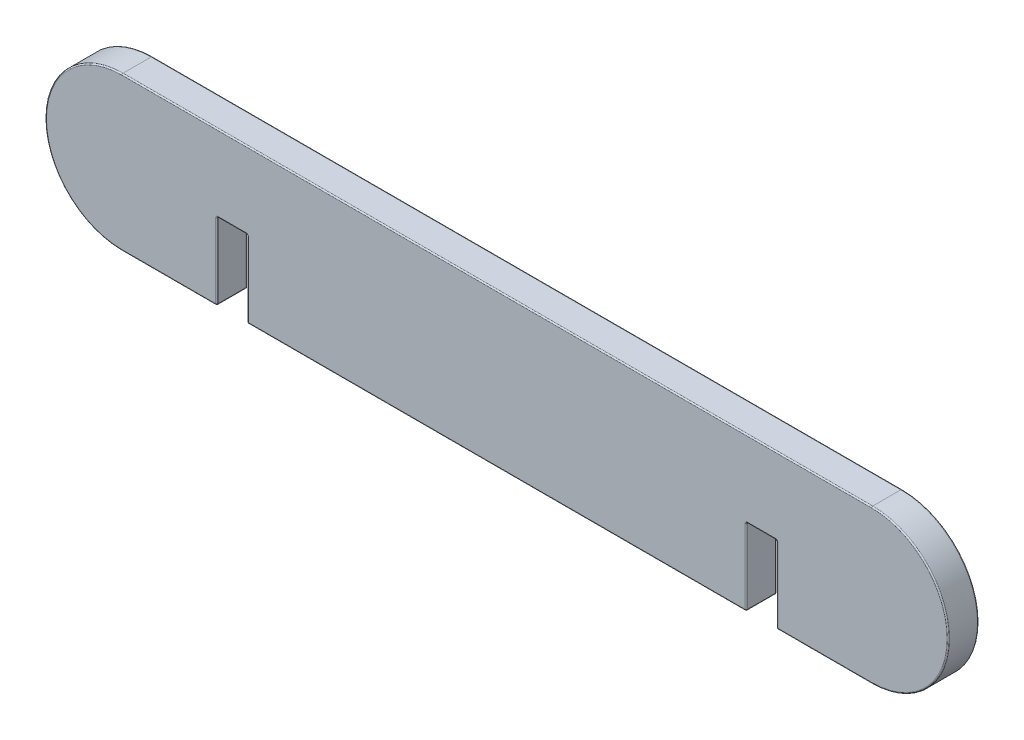
from build123d import *

# Parameters (mm, degrees)
RESSALTO_EXTRUS_O1_DEPTH = 2.5
FILETE1_R                = 0.1


with BuildPart() as part:
    # Esboço1 → Ressalto-extrusão1 (new body)
    with BuildSketch(Plane.XY):
        with BuildLine():
            Line((-184.814110363, 146.520645343), (-184.814110363, 152.820645343))
            Line((-184.814110363, 152.820645343), (-182.314110363, 152.820645343))
            Line((-182.314110363, 152.820645343), (-182.314110363, 146.520645343))
            Line((-182.314110363, 146.520645343), (-141.314110363, 146.520645343))
            Line((-141.314110363, 146.520645343), (-141.314110363, 152.820645343))
            Line((-141.314110363, 152.820645343), (-138.814110363, 152.820645343))
            Line((-138.814110363, 152.820645343), (-138.814110363, 146.520645343))
            Line((-138.814110363, 146.520645343), (-131.014110363, 146.520645343))
            ThreePointArc((-131.014110363, 146.520645343), (-124.714110363, 152.820645343), (-131.014110363, 159.120645343))
            Line((-131.014110363, 159.120645343), (-192.614110363, 159.120645343))
            ThreePointArc((-192.614110363, 159.120645343), (-198.914110363, 152.820645343), (-192.614110363, 146.520645343))
            Line((-192.614110363, 146.520645343), (-184.814110363, 146.520645343))
        make_face()
    extrude(amount=RESSALTO_EXTRUS_O1_DEPTH)

    # Filete1
    filete1_edges = [part.edges().sort_by_distance(p)[0] for p in [
        (-124.714110363, 152.820645343, 2.5),
        (-138.814110363, 149.670645343, 0),
        (-140.064110363, 152.820645343, 0),
        (-141.314110363, 149.670645343, 0),
        (-161.814110363, 159.120645343, 2.5),
        (-161.814110363, 146.520645343, 0),
        (-182.314110363, 149.670645343, 0),
        (-183.564110363, 152.820645343, 0),
        (-184.814110363, 149.670645343, 0),
        (-188.714110363, 146.520645343, 0),
        (-198.914110363, 152.820645343, 0),
        (-161.814110363, 159.120645343, 0),
        (-124.714110363, 152.820645343, 0),
        (-198.914110363, 152.820645343, 2.5),
        (-134.914110363, 146.520645343, 0),
        (-138.814110363, 146.520645343, 1.25),
        (-138.814110363, 152.820645343, 1.25),
        (-141.314110363, 152.820645343, 1.25),
        (-141.314110363, 146.520645343, 1.25),
        (-182.314110363, 146.520645343, 1.25),
        (-182.314110363, 152.820645343, 1.25),
        (-184.814110363, 152.820645343, 1.25),
        (-184.814110363, 146.520645343, 1.25),
        (-188.714110363, 146.520645343, 2.5),
        (-184.814110363, 149.670645343, 2.5),
        (-183.564110363, 152.820645343, 2.5),
        (-182.314110363, 149.670645343, 2.5),
        (-161.814110363, 146.520645343, 2.5),
        (-141.314110363, 149.670645343, 2.5),
        (-134.914110363, 146.520645343, 2.5),
        (-140.064110363, 152.820645343, 2.5),
        (-138.814110363, 149.670645343, 2.5),
    ]]
    fillet(filete1_edges, radius=FILETE1_R)


solid = part.part
